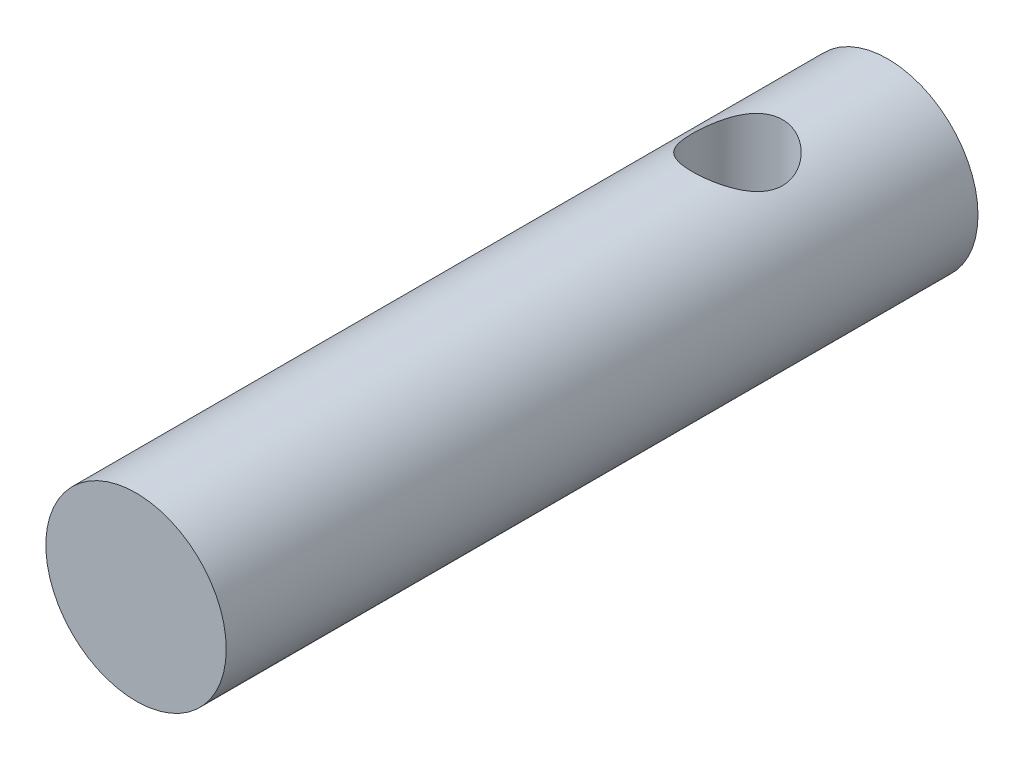
from build123d import *

# Parameters (mm, degrees)
SKETCH1_R               = 3
BOSS_EXTRUDE1_DEPTH     = 25
CUT_EXTRUDE1_DEPTH      = 26.357444666
CUT_EXTRUDE1_DEPTH_BACK = 26.357444666
SKETCH2_R               = 1.5


with BuildPart() as part:
    # Sketch1 → Boss-Extrude1 (new body)
    with BuildSketch(Plane.XY):
        Circle(SKETCH1_R)
    extrude(amount=BOSS_EXTRUDE1_DEPTH)

    # Sketch2 → Cut-Extrude1 (cut, two sides: drawn at the far end of the back side and taken through both)
    with BuildSketch(Plane(origin=(0, 0, 0), x_dir=(1, 0, 0), z_dir=(0, 1, 0)).offset(-CUT_EXTRUDE1_DEPTH_BACK)):
        with Locations(Location((0, -5, 0), (0, 0, 270))):
            Circle(SKETCH2_R)
    extrude(amount=CUT_EXTRUDE1_DEPTH + CUT_EXTRUDE1_DEPTH_BACK, mode=Mode.SUBTRACT)


solid = part.part
